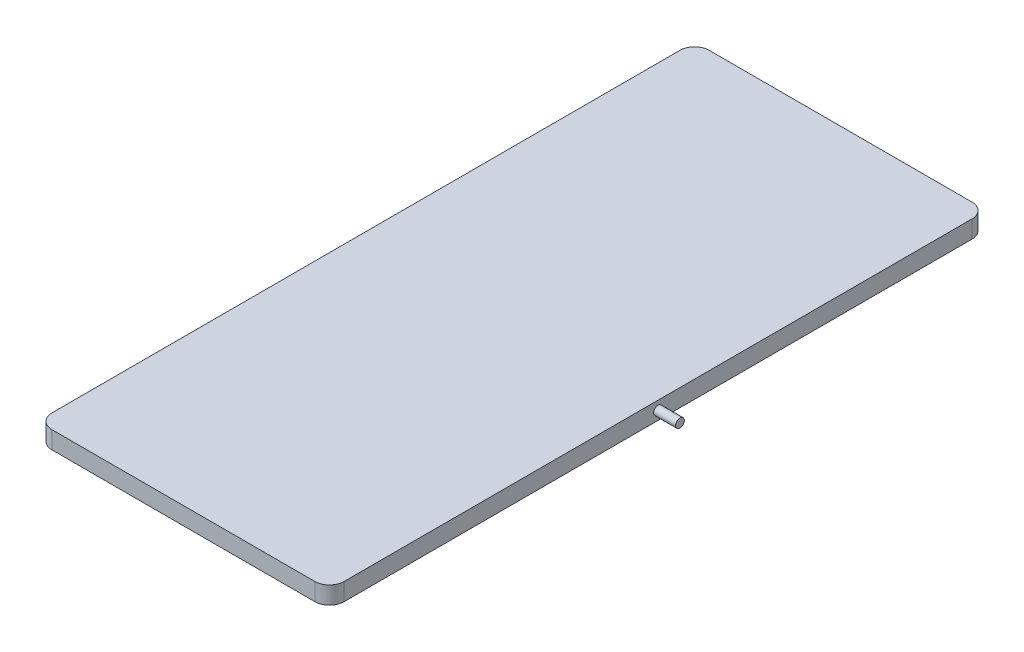
from build123d import *

# Parameters (mm, degrees)
SKETCH_1_W      = 200
SKETCH_1_H      = 450
EXTRUDE_1_DEPTH = 12
FILLET_1_R      = 10
SKETCH_2_R      = 3
EXTRUDE_2_DEPTH = 15


with BuildPart() as part:
    # 草图1 → 凸台-拉伸1 (new body)
    with BuildSketch(Plane(origin=(0, 0, 0), x_dir=(1, 0, 0), z_dir=(0, 1, 0))):
        with Locations((0, 225)):
            Rectangle(SKETCH_1_W, SKETCH_1_H)
    extrude(amount=EXTRUDE_1_DEPTH)

    # 圆角1
    fillet_1_edges = [part.edges().sort_by_distance(p)[0] for p in [
        (-100, 6, -450),
        (100, 6, -450),
        (100, 6, 0),
        (-100, 6, 0),
    ]]
    fillet(fillet_1_edges, radius=FILLET_1_R)

    # 草图2 → 凸台-拉伸2 (add)
    with BuildSketch(Plane(origin=(100, 0, 0), x_dir=(0, 0, -1), z_dir=(1, 0, 0))):
        with Locations(Location((225, 6, 0), (0, 0, 180))):
            Circle(SKETCH_2_R)
    extrude(amount=EXTRUDE_2_DEPTH)


solid = part.part
